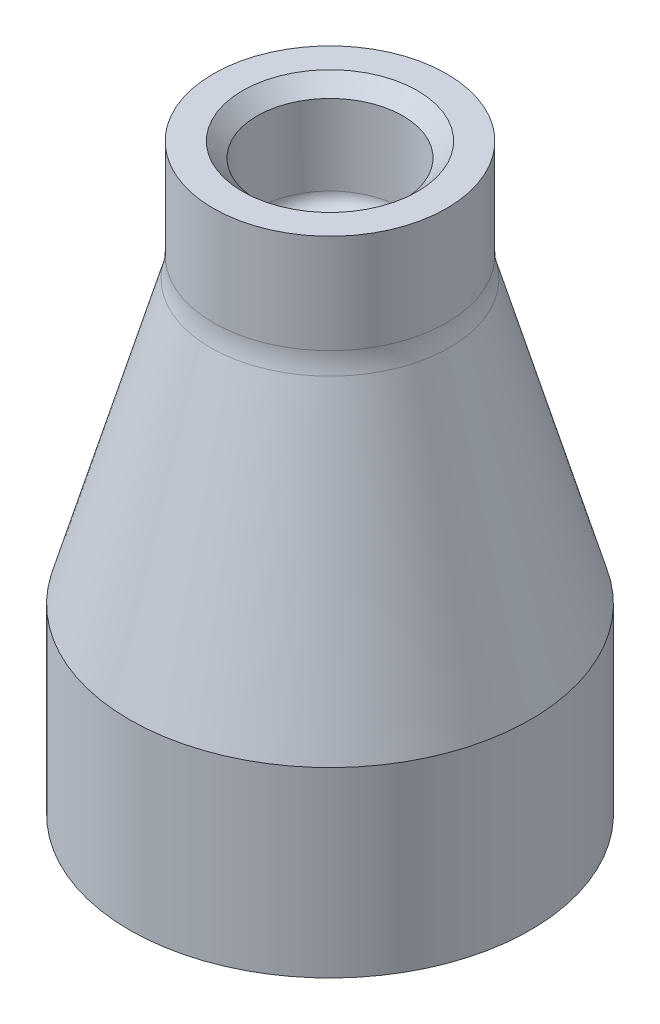
from build123d import *

# Parameters (mm, degrees)
SKETCH_2_R          = 10
CUT_EXTRUDE_1_DEPTH = 15
CHAMFER_1_SIZE      = 2
FILLET_1_R          = 2
FILLET_2_R          = 10


with BuildPart() as part:
    # 草图1 → 旋转1 (revolve)
    with BuildSketch(Plane.XY, mode=Mode.PRIVATE) as revolve_1_sk:
        Polygon((0, 0), (16, 0), (16, -15), (27.5, -55), (27.5, -80), (0, -80), align=None)
    revolve(revolve_1_sk.sketch.rotate(Axis((0, 36.444043321, 0), (0, -1, 0)), 90), axis=Axis((0, 36.444043321, 0), (0, -1, 0)))

    # 草图2 → 切除-拉伸1 (cut)
    with BuildSketch(Plane(origin=(0, 0, 0), x_dir=(1, 0, 0), z_dir=(0, 1, 0))):
        with Locations(Location((0, 0, 0), (0, 0, 270))):
            Circle(SKETCH_2_R)
    extrude(amount=-CUT_EXTRUDE_1_DEPTH, mode=Mode.SUBTRACT)

    # 倒角1
    chamfer_1_edges = [part.edges().sort_by_distance(p)[0] for p in [
        (0, 0, -10),
    ]]
    chamfer(chamfer_1_edges, length=CHAMFER_1_SIZE)

    # 圆角1
    fillet_1_edges = [part.edges().sort_by_distance(p)[0] for p in [
        (0, -15, -10),
    ]]
    fillet(fillet_1_edges, radius=FILLET_1_R)

    # 圆角2
    fillet_2_edges = [part.edges().sort_by_distance(p)[0] for p in [
        (0, -15, -16),
    ]]
    fillet(fillet_2_edges, radius=FILLET_2_R)


solid = part.part
